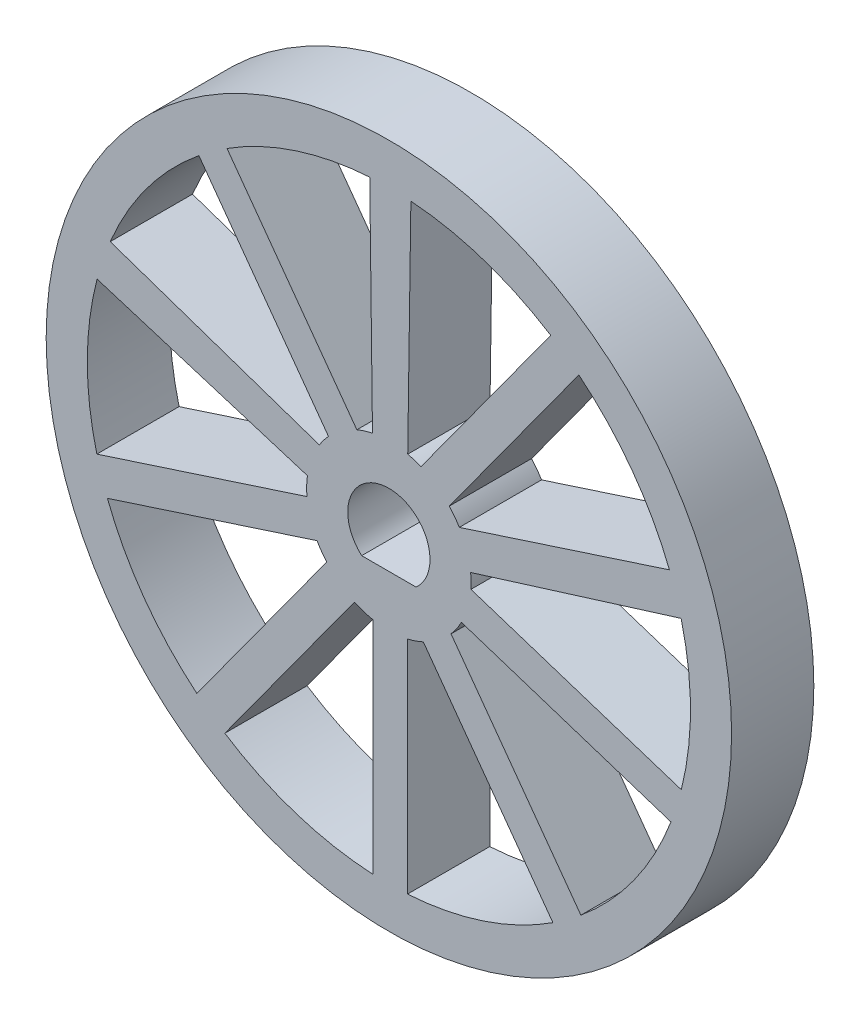
from build123d import *

# Parameters (mm, degrees)
SKETCH1_R           = 25
BOSS_EXTRUDE2_DEPTH = 6


with BuildPart() as part:
    # Sketch1 → Boss-Extrude2 (new body)
    with BuildSketch(Plane.XY):
        Circle(SKETCH1_R)
        with BuildLine():
            Line((-4.534391195, -3.929287021), (-14.005896945, -16.965696295))
            ThreePointArc((-14.005896945, -16.965696295), (-17.85403181, -12.854320212), (-20.532375114, -7.900732383))
            Line((-20.532375114, -7.900732383), (-5.235649328, -2.930524888))
            ThreePointArc((-5.235649328, -2.930524888), (-4.91047904, -3.447781257), (-4.534391195, -3.929287021))
        make_face(mode=Mode.SUBTRACT)
        with BuildLine():
            Line((-2.513596268, -5.448103688), (-11.967457053, -18.460226751))
            ThreePointArc((-11.967457053, -18.460226751), (-6.798373876, -20.923243358), (-1.168772903, -21.968931924))
            Line((-1.168772903, -21.968931924), (-1.168772903, -5.885063288))
            ThreePointArc((-1.168772903, -5.885063288), (-1.854101966, -5.706339098), (-2.513596268, -5.448103688))
        make_face(mode=Mode.SUBTRACT)
        with BuildLine():
            Line((-1.984313483, -2.25), (1.984313483, -2.25))
            ThreePointArc((1.984313483, -2.25), (0, 3), (-1.984313483, -2.25))
        make_face(mode=Mode.SUBTRACT)
        with BuildLine():
            Line((2.513209972, -5.448281898), (11.967106425, -18.460454052))
            ThreePointArc((11.967106425, -18.460454052), (6.888635303, -20.893700095), (1.358822573, -21.957996293))
            Line((1.358822573, -21.957996293), (1.358822573, -5.844108248))
            ThreePointArc((1.358822573, -5.844108248), (1.946106018, -5.675620791), (2.513209972, -5.448281898))
        make_face(mode=Mode.SUBTRACT)
        with BuildLine():
            Line((-21.303090338, -5.493481779), (-5.977939812, -0.514038525))
            ThreePointArc((-5.977939812, -0.514038525), (-5.997955792, 0.156608815), (-5.942969251, 0.825297812))
            Line((-5.942969251, 0.825297812), (-21.282827475, 5.571467909))
            ThreePointArc((-21.282827475, 5.571467909), (-21.999963111, 0.040287778), (-21.303090338, -5.493481779))
        make_face(mode=Mode.SUBTRACT)
        with BuildLine():
            Line((4.534110635, -3.929610763), (14.005574543, -16.965962446))
            ThreePointArc((14.005574543, -16.965962446), (17.888250951, -12.806657562), (20.574373634, -7.790709183))
            Line((20.574373634, -7.790709183), (5.293061004, -2.825509725))
            ThreePointArc((5.293061004, -2.825509725), (4.944500519, -3.398810765), (4.534110635, -3.929610763))
        make_face(mode=Mode.SUBTRACT)
        with BuildLine():
            Line((-11.80762859, 18.562863655), (-2.336164682, 5.526511972))
            ThreePointArc((-2.336164682, 5.526511972), (-1.774817269, 5.731494017), (-1.195863246, 5.879618278))
            Line((-1.195863246, 5.879618278), (-1.395173787, 21.95571657))
            ThreePointArc((-1.395173787, 21.95571657), (-6.815890285, 20.917543824), (-11.80762859, 18.562863655))
        make_face(mode=Mode.SUBTRACT)
        with BuildLine():
            Line((-13.858895862, 17.085988572), (-4.404999409, 4.073816417))
            ThreePointArc((-4.404999409, 4.073816417), (-4.759982517, 3.652747793), (-5.074861212, 3.200903573))
            Line((-5.074861212, 3.200903573), (-20.326913466, 8.415259293))
            ThreePointArc((-20.326913466, 8.415259293), (-17.634136679, 13.154361391), (-13.858895862, 17.085988572))
        make_face(mode=Mode.SUBTRACT)
        with BuildLine():
            Line((13.858571335, 17.0862518), (4.40471055, 4.074128737))
            ThreePointArc((4.40471055, 4.074128737), (4.796457199, 3.604718899), (5.138399164, 3.097878958))
            Line((5.138399164, 3.097878958), (20.46354969, 8.077322211))
            ThreePointArc((20.46354969, 8.077322211), (17.742384309, 13.007989815), (13.858571335, 17.0862518))
        make_face(mode=Mode.SUBTRACT)
        with BuildLine():
            Line((11.807275837, 18.563088032), (2.335770087, 5.526678758))
            ThreePointArc((2.335770087, 5.526678758), (1.862276825, 5.703676448), (1.375565326, 5.840190068))
            Line((1.375565326, 5.840190068), (1.604826213, 21.94138858))
            ThreePointArc((1.604826213, 21.94138858), (6.915515093, 20.884818673), (11.807275837, 18.563088032))
        make_face(mode=Mode.SUBTRACT)
        with BuildLine():
            Line((21.332214938, -5.379275588), (5.987092878, -0.39334319))
            ThreePointArc((5.987092878, -0.39334319), (5.998482577, 0.134932498), (5.963349889, 0.662161691))
            Line((5.963349889, 0.662161691), (21.31722763, 5.438364293))
            ThreePointArc((21.31722763, 5.438364293), (21.999978886, 0.030479888), (21.332214938, -5.379275588))
        make_face(mode=Mode.SUBTRACT)
    extrude(amount=BOSS_EXTRUDE2_DEPTH)


solid = part.part
